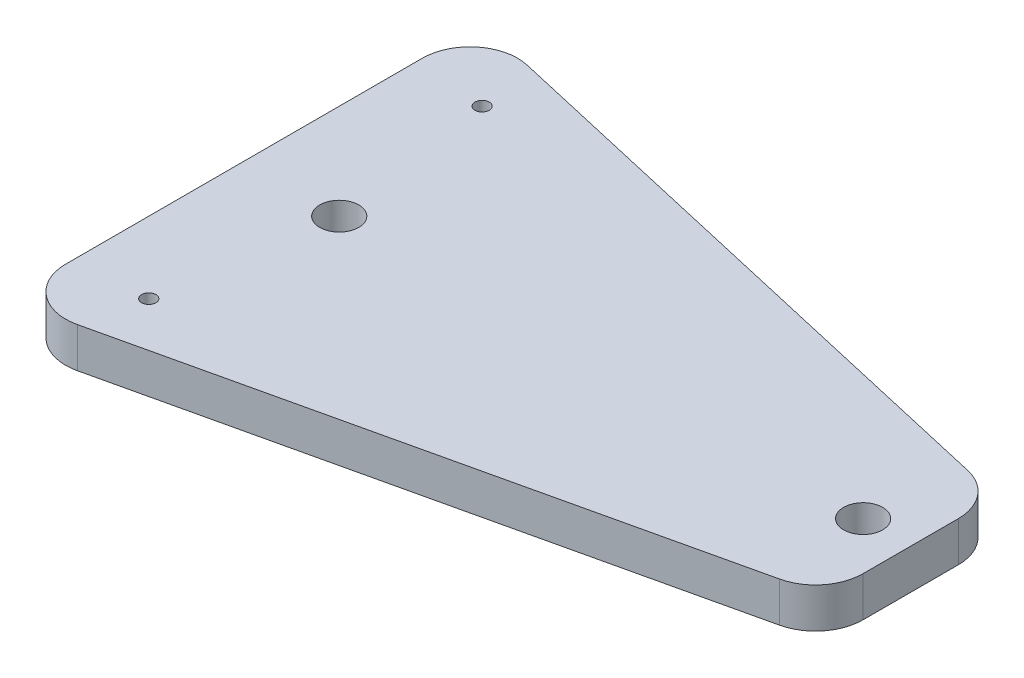
from build123d import *

# Parameters (mm, degrees)
SKETCH_1_R          = 4.1
SKETCH_1_R_2        = 1.5
EXTRUDE_1_DEPTH     = 8.4
SKETCH_2_W          = 10.2
SKETCH_2_H          = 10.2
CUT_EXTRUDE_1_DEPTH = 5


with BuildPart() as part:
    # ｽｹｯﾁ1 → ﾎﾞｽ - 押し出し1 (new body)
    with BuildSketch(Plane(origin=(0, 0, 0), x_dir=(1, 0, 0), z_dir=(0, 1, 0))):
        with BuildLine():
            Line((-90.755581693, -47.201953746), (29.244418307, -19.748139436))
            ThreePointArc((29.244418307, -19.748139436), (34.834131004, -16.232897902), (37.014221558, -10))
            Line((37.014221558, -10), (37.014221558, 10))
            ThreePointArc((37.014221558, 10), (34.834131004, 16.232897902), (29.244418307, 19.748139436))
            Line((29.244418307, 19.748139436), (-90.755581693, 47.201953746))
            ThreePointArc((-90.755581693, 47.201953746), (-99.218676344, 45.273723756), (-102.985778442, 37.45381431))
            Line((-102.985778442, 37.45381431), (-102.985778442, -37.45381431))
            ThreePointArc((-102.985778442, -37.45381431), (-99.218676344, -45.273723756), (-90.755581693, -47.201953746))
        make_face()
        with Locations(Location((-82.985778442, 0, 0), (0, 0, 270))):
            Circle(SKETCH_1_R, mode=Mode.SUBTRACT)
        with Locations(Location((27.014221558, 0, 0), (0, 0, 270))):
            Circle(SKETCH_1_R, mode=Mode.SUBTRACT)
        with Locations(Location((-87.985778442, 35, 0), (0, 0, 270))):
            Circle(SKETCH_1_R_2, mode=Mode.SUBTRACT)
        with Locations(Location((-87.985778442, -35, 0), (0, 0, 270))):
            Circle(SKETCH_1_R_2, mode=Mode.SUBTRACT)
    extrude(amount=EXTRUDE_1_DEPTH)

    # ｽｹｯﾁ2 → ｶｯﾄ - 押し出し1 (cut)
    with BuildSketch(Plane.XZ):
        with Locations((-87.985778442, 35)):
            Rectangle(SKETCH_2_W, SKETCH_2_H)
        with Locations((-87.985778442, -35)):
            Rectangle(SKETCH_2_W, SKETCH_2_H)
    extrude(amount=-CUT_EXTRUDE_1_DEPTH, mode=Mode.SUBTRACT)


solid = part.part
